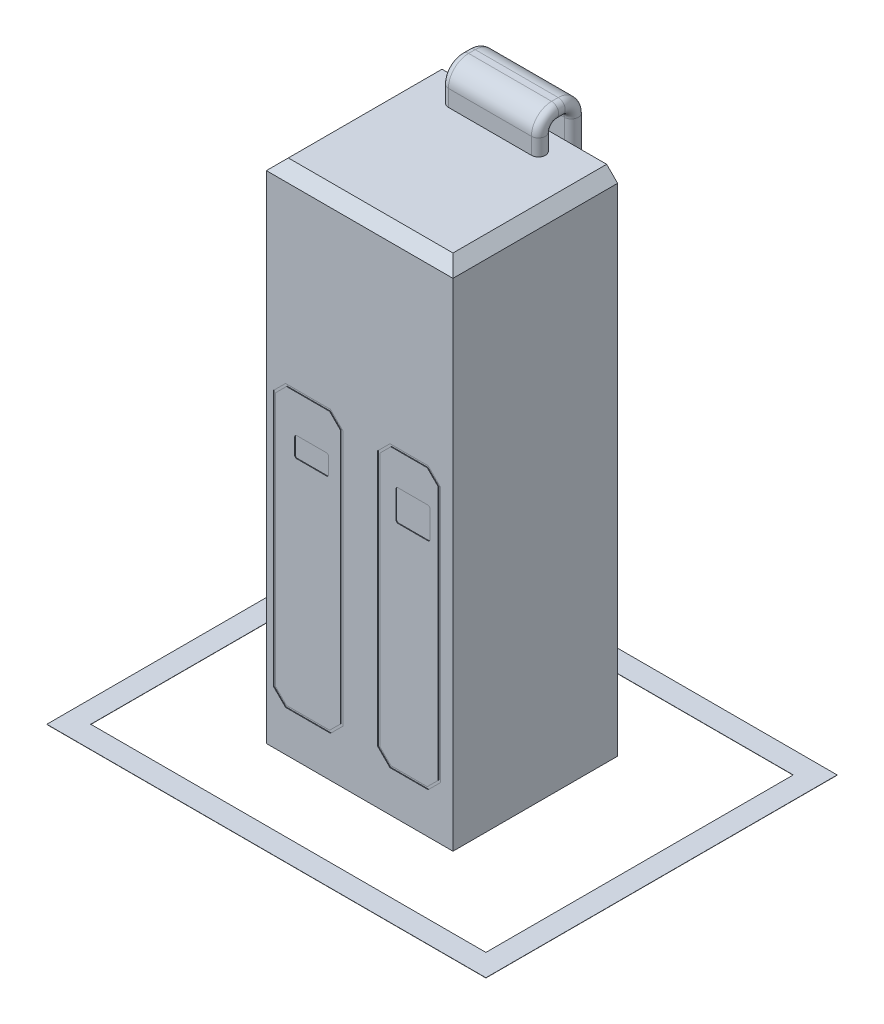
from build123d import *

# Parameters (mm, degrees)
CROQUIS1_W              = 850
CROQUIS1_H              = 750
SALIENTE_EXTRUIR1_DEPTH = 2310
CORTAR_EXTRUIR1_DEPTH   = 3
CORTAR_EXTRUIR2_DEPTH   = 3
CORTAR_EXTRUIR3_DEPTH   = 3
CORTAR_EXTRUIR4_DEPTH   = 3
CHAFL_N1_SIZE           = 50
CROQUIS7_W              = 2000
CROQUIS7_H              = 1600
CROQUIS7_W_2            = 1800
CROQUIS7_H_2            = 1400
SALIENTE_EXTRUIR2_DEPTH = 1


with BuildPart() as part:
    # Croquis1 → Saliente-Extruir1 (new body)
    with BuildSketch(Plane(origin=(0, 0, 0), x_dir=(1, 0, 0), z_dir=(0, 1, 0))):
        Rectangle(CROQUIS1_W, CROQUIS1_H)
    extrude(amount=SALIENTE_EXTRUIR1_DEPTH)

    # Croquis2 → Cortar-Extruir1 (cut)
    # profile 1 of 2: a face of its own
    with BuildSketch(Plane.XY.offset(375)):
        Polygon((-393.483471659, 1408.259243518), (-393.483471659, 242.149185229), (-337.625607283, 186.291320853), (-132.780784619, 186.291320853), (-76.922920243, 242.149185229), (-76.922920243, 1408.259243518), (-132.780784619, 1464.117107894), (-337.625607283, 1464.117107894), align=None)
        Polygon((-383.483471659, 1404.117107894), (-333.483471659, 1454.117107894), (-136.922920243, 1454.117107894), (-86.922920243, 1404.117107894), (-86.922920243, 246.291320853), (-136.922920243, 196.291320853), (-333.483471659, 196.291320853), (-383.483471659, 246.291320853), align=None, mode=Mode.SUBTRACT)
    # profile 2 of 2: a face of its own
    with BuildSketch(Plane.XY.offset(375)):
        Polygon((82.036033198, 1408.259243518), (82.036033198, 242.149185229), (137.893897574, 186.291320853), (312.060042505, 186.291320853), (367.917906882, 242.149185229), (367.917906882, 1408.259243518), (312.060042505, 1464.117107894), (137.893897574, 1464.117107894), align=None)
        Polygon((307.917906882, 1454.117107894), (142.036033198, 1454.117107894), (92.036033198, 1404.117107894), (92.036033198, 246.291320853), (142.036033198, 196.291320853), (307.917906882, 196.291320853), (357.917906882, 246.291320853), (357.917906882, 1404.117107894), align=None, mode=Mode.SUBTRACT)
    extrude(amount=-CORTAR_EXTRUIR1_DEPTH, mode=Mode.SUBTRACT)

    # Croquis3 → Cortar-Extruir2 (cut)
    with BuildSketch(Plane.XY.offset(375)):
        with BuildLine():
            Line((-286.091039819, 1283.918898277), (-151.104405159, 1283.918898277))
            ThreePointArc((-151.104405159, 1283.918898277), (-144.033337347, 1280.989966089), (-141.104405159, 1273.918898277))
            Line((-141.104405159, 1273.918898277), (-141.104405159, 1202.335886887))
            ThreePointArc((-141.104405159, 1202.335886887), (-144.033337347, 1195.264819075), (-151.104405159, 1192.335886887))
            Line((-151.104405159, 1192.335886887), (-286.091039819, 1192.335886887))
            ThreePointArc((-286.091039819, 1192.335886887), (-293.162107631, 1195.264819075), (-296.091039819, 1202.335886887))
            Line((-296.091039819, 1202.335886887), (-296.091039819, 1273.918898277))
            ThreePointArc((-296.091039819, 1273.918898277), (-293.162107631, 1280.989966089), (-286.091039819, 1283.918898277))
        make_face()
        with BuildLine():
            Line((175.346440647, 1308.575862882), (310.333075308, 1308.575862882))
            ThreePointArc((310.333075308, 1308.575862882), (317.40414312, 1305.646930694), (320.333075308, 1298.575862882))
            Line((320.333075308, 1298.575862882), (320.333075308, 1177.678922282))
            ThreePointArc((320.333075308, 1177.678922282), (317.40414312, 1170.60785447), (310.333075308, 1167.678922282))
            Line((310.333075308, 1167.678922282), (175.346440647, 1167.678922282))
            ThreePointArc((175.346440647, 1167.678922282), (168.275372835, 1170.60785447), (165.346440647, 1177.678922282))
            Line((165.346440647, 1177.678922282), (165.346440647, 1298.575862882))
            ThreePointArc((165.346440647, 1298.575862882), (168.275372835, 1305.646930694), (175.346440647, 1308.575862882))
        make_face()
    extrude(amount=-CORTAR_EXTRUIR2_DEPTH, mode=Mode.SUBTRACT)

    # Croquis4 → Cortar-Extruir3 (cut)
    with BuildSketch(Plane.ZY.offset(425)):
        with BuildLine():
            Line((109.212006175, 1691.86792005), (109.212006175, 898.703809809))
            ThreePointArc((109.212006175, 898.703809809), (0, 789.491803634), (-109.212006175, 898.703809809))
            Line((-109.212006175, 898.703809809), (-109.212006175, 1691.86792005))
            ThreePointArc((-109.212006175, 1691.86792005), (0, 1801.079926225), (109.212006175, 1691.86792005))
        make_face()
    extrude(amount=-CORTAR_EXTRUIR3_DEPTH, mode=Mode.SUBTRACT)

    # Croquis5 → Cortar-Extruir4 (cut)
    with BuildSketch(Plane.ZY.offset(425)):
        Polygon((201.868660443, 1968.212358458), (211.868660443, 2018.212358458), (211.868660443, 2121.90902677), (181.868660443, 2171.90902677), (-181.868660443, 2171.90902677), (-211.868660443, 2121.90902677), (-211.868660443, 1998.212358458), (-161.868660443, 1968.212358458), align=None)
    extrude(amount=-CORTAR_EXTRUIR4_DEPTH, mode=Mode.SUBTRACT)

    # Barrer1: sweep along a curve in space
    with BuildLine() as barrer1_path:
        Line((-20.695933391, 2310, -270.928582575), (-20.695933391, 2385.014260788, -270.928582575))
        ThreePointArc((-20.695933391, 2385.014260788, -270.928582575), (-20.695933391, 2427.440667659, -288.502175703), (-20.695933391, 2445.014260788, -330.928582575))
        Line((-20.695933391, 2445.014260788, -330.928582575), (-20.695933391, 2445.014260788, -360.928582575))
        ThreePointArc((-20.695933391, 2445.014260788, -360.928582575), (-20.695933391, 2427.440667659, -403.354989446), (-20.695933391, 2385.014260788, -420.928582575))
        Line((-20.695933391, 2385.014260788, -420.928582575), (-20.695933391, 94.913979235, -420.928582575))
    # Croquis6 → Barrer1 (sweep)
    with BuildSketch(Plane(origin=(0, 2310, 0), x_dir=(1, 0, 0), z_dir=(0, 1, 0))):
        with BuildLine():
            Line((168.389639864, 238.943958243), (-209.781506646, 238.943958243))
            ThreePointArc((-209.781506646, 238.943958243), (-241.766130978, 270.928582575), (-209.781506646, 302.913206906))
            Line((-209.781506646, 302.913206906), (168.389639864, 302.913206906))
            ThreePointArc((168.389639864, 302.913206906), (200.374264196, 270.928582575), (168.389639864, 238.943958243))
        make_face()
    sweep(path=barrer1_path.line)

    # Chaflán1
    chafl_n1_edges = [part.edges().sort_by_distance(p)[0] for p in [
        (-425, 2310, 0),
        (0, 2310, 375),
        (425, 2310, 0),
    ]]
    chamfer(chafl_n1_edges, length=CHAFL_N1_SIZE)


with BuildPart() as body_2:
    # Croquis7 → Saliente-Extruir2 (new body)
    with BuildSketch(Plane(origin=(0, 0, 0), x_dir=(1, 0, 0), z_dir=(0, 1, 0))):
        Rectangle(CROQUIS7_W, CROQUIS7_H)
        Rectangle(CROQUIS7_W_2, CROQUIS7_H_2, mode=Mode.SUBTRACT)
    extrude(amount=SALIENTE_EXTRUIR2_DEPTH)


solid = Compound([part.part, body_2.part])
